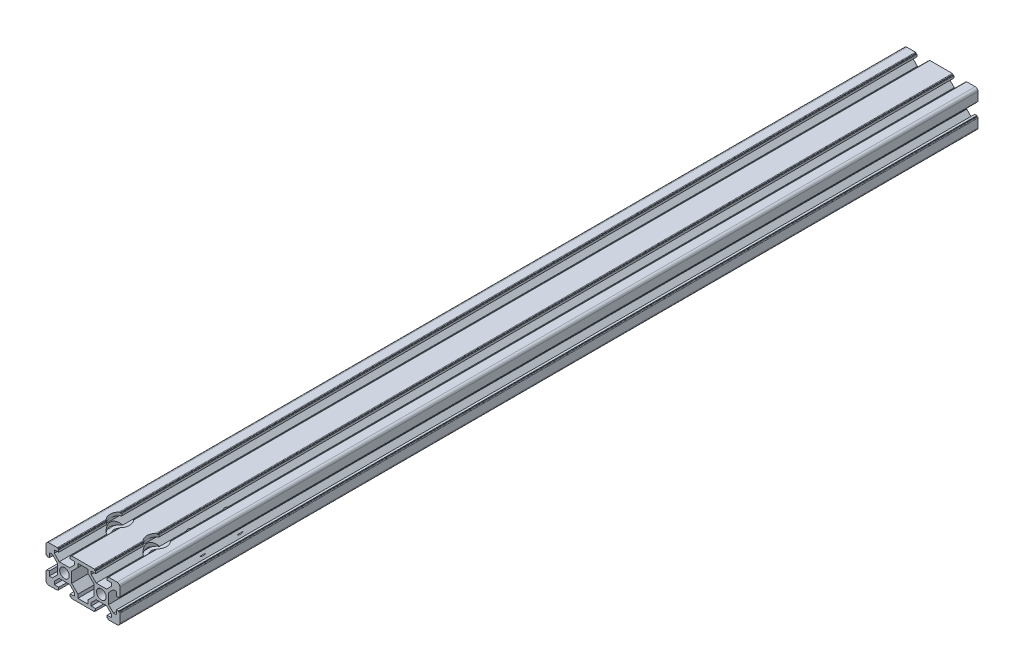
from build123d import *

# Parameters (mm, degrees)
SKETCH_1_R               = 2.6
EXTRUDE_1_DEPTH          = 232.5
FILLET_1_R               = 1.5
FILLET_2_R               = 0.3
CUT_EXTRUDE_1_DEPTH      = 234.772239584
CUT_EXTRUDE_1_DEPTH_BACK = 234.772239584
SKETCH_2_R               = 3.1
SKETCH_3_R               = 5.25
CUT_EXTRUDE_2_DEPTH      = 234.772239683
CUT_EXTRUDE_3_DEPTH      = 234.772239683
CUT_EXTRUDE_3_DEPTH_BACK = 234.772239683
SKETCH_4_R               = 3.1
SKETCH_6_R               = 5.25
CUT_EXTRUDE_4_DEPTH      = 234.772239689


with BuildPart() as part:
    # 草图1 → 凸台-拉伸1 (new, symmetric)
    with BuildSketch(Plane.XY):
        Polygon((-13.9, 0), (-13.9, 2.839339828), (-16.560660172, 5.5), (-18.2, 5.5), (-18.2, 3.1), (-19.4, 3.1), (-19.4, 3.6), (-20, 3.6), (-20, 10), (-13.6, 10), (-13.6, 9.4), (-13.1, 9.4), (-13.1, 8.2), (-15.5, 8.2), (-15.5, 6.560660172), (-12.839339828, 3.9), (-7.160660172, 3.9), (-4.5, 6.560660172), (-4.5, 8.2), (-6.9, 8.2), (-6.9, 9.4), (-6.4, 9.4), (-6.4, 10), (6.4, 10), (6.4, 9.4), (6.9, 9.4), (6.9, 8.2), (4.5, 8.2), (4.5, 6.560660172), (7.160660172, 3.9), (12.839339828, 3.9), (15.5, 6.560660172), (15.5, 8.2), (13.1, 8.2), (13.1, 9.4), (13.6, 9.4), (13.6, 10), (20, 10), (20, 3.6), (19.4, 3.6), (19.4, 3.1), (18.2, 3.1), (18.2, 5.5), (16.560660172, 5.5), (13.9, 2.839339828), (13.9, 0), (13.9, -2.839339828), (16.560660172, -5.5), (18.2, -5.5), (18.2, -3.1), (19.4, -3.1), (19.4, -3.6), (20, -3.6), (20, -10), (13.6, -10), (13.6, -9.4), (13.1, -9.4), (13.1, -8.2), (15.5, -8.2), (15.5, -6.560660172), (12.839339828, -3.9), (7.160660172, -3.9), (4.5, -6.560660172), (4.5, -8.2), (6.9, -8.2), (6.9, -9.4), (6.4, -9.4), (6.4, -10), (-6.4, -10), (-6.4, -9.4), (-6.9, -9.4), (-6.9, -8.2), (-4.5, -8.2), (-4.5, -6.560660172), (-7.160660172, -3.9), (-12.839339828, -3.9), (-15.5, -6.560660172), (-15.5, -8.2), (-13.1, -8.2), (-13.1, -9.4), (-13.6, -9.4), (-13.6, -10), (-20, -10), (-20, -3.6), (-19.4, -3.6), (-19.4, -3.1), (-18.2, -3.1), (-18.2, -5.5), (-16.560660172, -5.5), (-13.9, -2.839339828), align=None)
        with Locations((-10, 0)):
            Circle(SKETCH_1_R, mode=Mode.SUBTRACT)
        with Locations(Location((10, 0, 0), (0, 0, 180))):
            Circle(SKETCH_1_R, mode=Mode.SUBTRACT)
        Polygon((-6.1, -2.839339828), (-6.1, 2.839339828), (-2.7, 6.239339828), (-2.7, 8.2), (2.7, 8.2), (2.7, 6.239339828), (6.1, 2.839339828), (6.1, -2.839339828), (2.7, -6.239339828), (2.7, -8.2), (-2.7, -8.2), (-2.7, -6.239339828), align=None, mode=Mode.SUBTRACT)
    extrude(amount=EXTRUDE_1_DEPTH, both=True)

    # 圆角1
    fillet_1_edges = [part.edges().sort_by_distance(p)[0] for p in [
        (-20, 10, 0),
        (20, 10, 0),
        (20, -10, 0),
        (-20, -10, 0),
    ]]
    fillet(fillet_1_edges, radius=FILLET_1_R)

    # 圆角2
    fillet_2_edges = [part.edges().sort_by_distance(p)[0] for p in [
        (-20, 3.6, 0),
        (-13.6, 10, 0),
        (-6.4, 10, 0),
        (6.4, 10, 0),
        (13.6, 10, 0),
        (20, 3.6, 0),
        (20, -3.6, 0),
        (13.6, -10, 0),
        (6.4, -10, 0),
        (-6.4, -10, 0),
        (-13.6, -10, 0),
        (-20, -3.6, 0),
    ]]
    fillet(fillet_2_edges, radius=FILLET_2_R)

    # 草图2 → 切除-拉伸1 (cut, two sides: drawn at the far end of the back side and taken through both)
    with BuildSketch(Plane.XZ.offset(3.9).offset(-CUT_EXTRUDE_1_DEPTH_BACK)):
        with Locations(Location((-10, 202.5, 0), (0, 0, 336.336158428))):
            Circle(SKETCH_2_R)
        with Locations(Location((10, 202.5, 0), (0, 0, 203.663841572))):
            Circle(SKETCH_2_R)
    extrude(amount=CUT_EXTRUDE_1_DEPTH + CUT_EXTRUDE_1_DEPTH_BACK, mode=Mode.SUBTRACT)

    # 草图3 → 切除-拉伸2 (cut, through all)
    with BuildSketch(Plane(origin=(0, 3.9, 0), x_dir=(1, 0, 0), z_dir=(0, 1, 0))):
        with Locations((-10, -202.5)):
            Circle(SKETCH_3_R)
        with Locations((10, -202.5)):
            Circle(SKETCH_3_R)
    extrude(amount=CUT_EXTRUDE_2_DEPTH, mode=Mode.SUBTRACT)

    # 草图4 → 切除-拉伸3 (cut, two sides: drawn at the far end of the back side and taken through both)
    with BuildSketch(Plane(origin=(0, 3.9, 0), x_dir=(1, 0, 0), z_dir=(0, 1, 0)).offset(-CUT_EXTRUDE_3_DEPTH_BACK)):
        with Locations(Location((10, -182.5, 0), (0, 0, 203.663841572))):
            Circle(SKETCH_4_R)
        with Locations(Location((10, -162.5, 0), (0, 0, 203.663841572))):
            Circle(SKETCH_4_R)
    extrude(amount=CUT_EXTRUDE_3_DEPTH + CUT_EXTRUDE_3_DEPTH_BACK, mode=Mode.SUBTRACT)

    # 草图6 → 切除-拉伸4 (cut, through all)
    with BuildSketch(Plane.XZ.offset(3.9)):
        with Locations((10, 182.5)):
            Circle(SKETCH_6_R)
        with Locations((10, 162.5)):
            Circle(SKETCH_6_R)
    extrude(amount=CUT_EXTRUDE_4_DEPTH, mode=Mode.SUBTRACT)


solid = part.part
